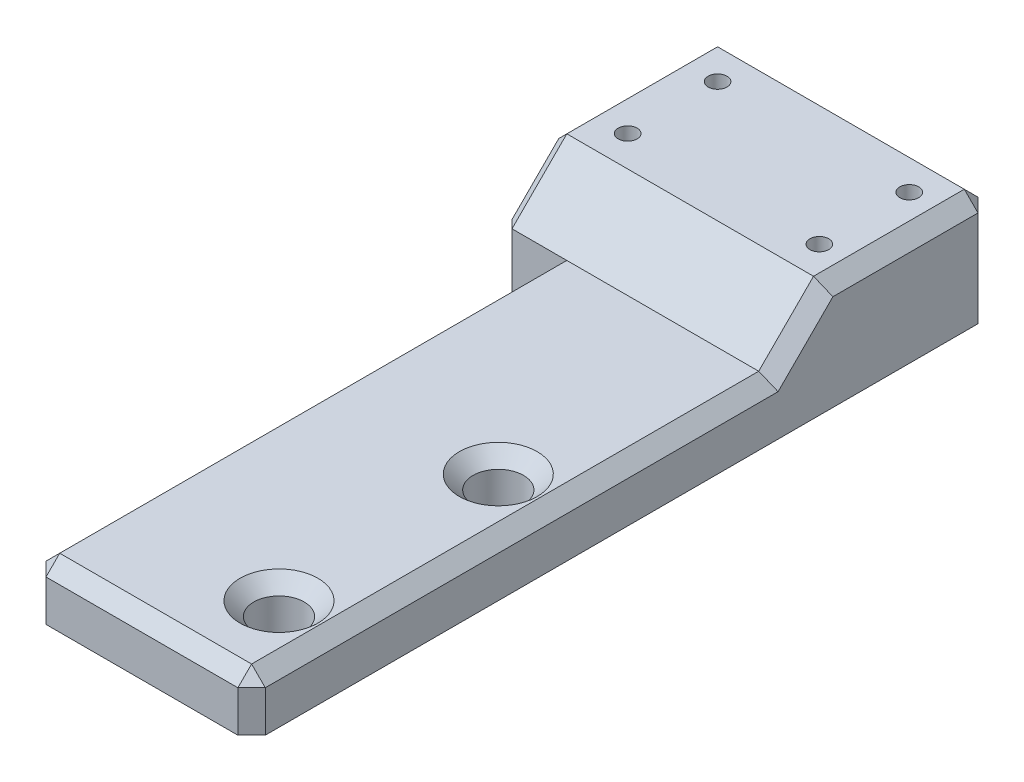
from build123d import *

# Parameters (mm, degrees)
SKETCH1_W           = 31.75
SKETCH1_H           = 85.725
SKETCH1_R           = 2.921
BOSS_EXTRUDE1_DEPTH = 12.7
SKETCH2_W           = 60.325
SKETCH2_H           = 6.35
CUT_EXTRUDE1_DEPTH  = 93.293705771
SKETCH3_R           = 1.0922
SKETCH3_W           = 6.35
SKETCH3_H           = 60.325
CUT_EXTRUDE2_DEPTH  = 93.293705771
CHAMFER1_SIZE       = 6.35
CHAMFER2_SIZE       = 1.5875


with BuildPart() as part:
    # Sketch1 → Boss-Extrude1 (new body)
    with BuildSketch(Plane(origin=(0, 0, 0), x_dir=(1, 0, 0), z_dir=(0, 1, 0))):
        with Locations((15.875, 42.8625)):
            Rectangle(SKETCH1_W, SKETCH1_H)
        with Locations(Location((25.4, 9.525, 0), (0, 0, 270))):
            Circle(SKETCH1_R, mode=Mode.SUBTRACT)
        with Locations(Location((25.4, 34.925, 0), (0, 0, 270))):
            Circle(SKETCH1_R, mode=Mode.SUBTRACT)
    extrude(amount=BOSS_EXTRUDE1_DEPTH)

    # Sketch2 → Cut-Extrude1 (cut, through all)
    with BuildSketch(Plane(origin=(31.75, 0, 0), x_dir=(0, 0, -1), z_dir=(1, 0, 0))):
        with Locations((30.1625, 9.525)):
            Rectangle(SKETCH2_W, SKETCH2_H)
    extrude(amount=-CUT_EXTRUDE1_DEPTH, mode=Mode.SUBTRACT)

    # Sketch3 → Cut-Extrude2 (cut, through all)
    with BuildSketch(Plane.XZ):
        with Locations(Location((27.2796, -70.231, 0), (0, 0, 270))):
            Circle(SKETCH3_R)
        with Locations(Location((5.08, -80.645, 0), (0, 0, 270))):
            Circle(SKETCH3_R)
        with Locations(Location((27.2796, -80.645, 0), (0, 0, 270))):
            Circle(SKETCH3_R)
        with Locations(Location((5.08, -70.231, 0), (0, 0, 270))):
            Circle(SKETCH3_R)
        with Locations((3.175, -30.1625)):
            Rectangle(SKETCH3_W, SKETCH3_H)
    extrude(amount=-CUT_EXTRUDE2_DEPTH, mode=Mode.SUBTRACT)

    # Chamfer1
    chamfer1_edges = [part.edges().sort_by_distance(p)[0] for p in [
        (15.875, 12.7, -60.325),
    ]]
    chamfer(chamfer1_edges, length=CHAMFER1_SIZE)

    # Chamfer2
    chamfer2_edges = [part.edges().sort_by_distance(p)[0] for p in [
        (15.875, 12.7, -85.725),
        (31.75, 3.175, 0),
        (25.4, 6.35, -12.446),
        (25.4, 6.35, -37.846),
        (0, 3.175, -60.325),
        (31.75, 6.35, -30.1625),
        (19.05, 6.35, 0),
        (6.35, 6.35, -30.1625),
        (0, 12.7, -76.2),
        (6.35, 3.175, 0),
        (0, 6.35, -85.725),
        (31.75, 6.35, -85.725),
        (31.75, 12.7, -76.2),
        (31.75, 9.525, -63.5),
        (0, 9.525, -63.5),
    ]]
    chamfer(chamfer2_edges, length=CHAMFER2_SIZE)


solid = part.part
